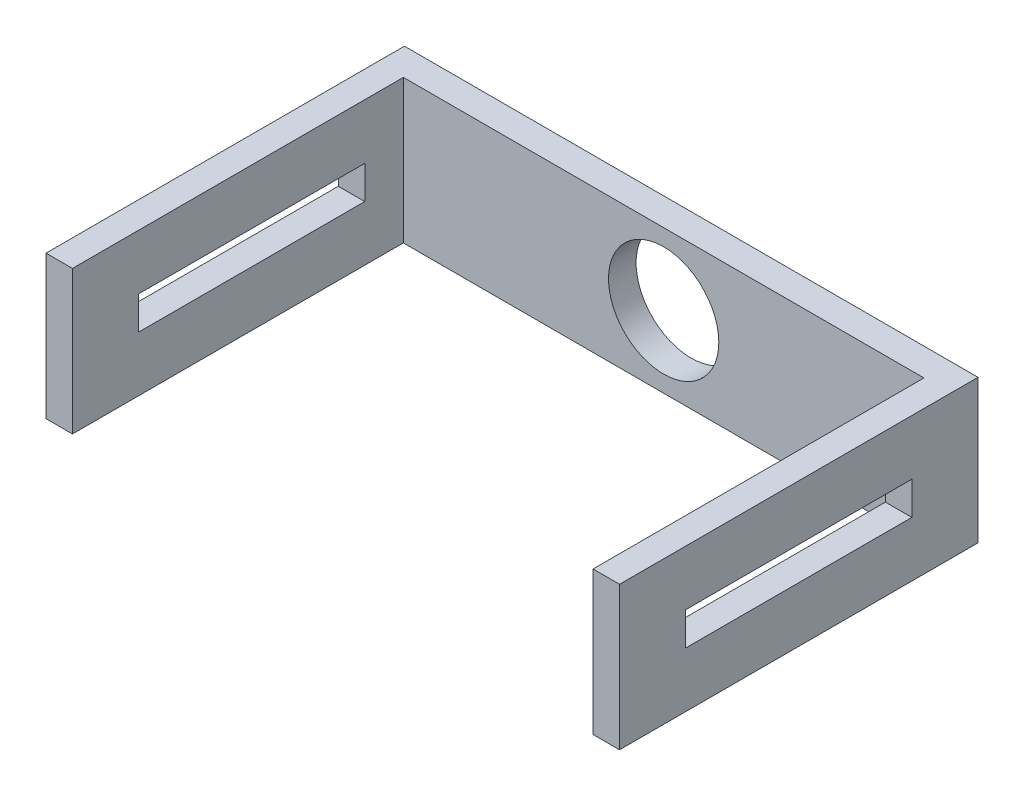
from build123d import *

# Parameters (mm, degrees)
SKETCH1_W           = 52
SKETCH1_H           = 13
BOSS_EXTRUDE1_DEPTH = 2.5
SKETCH2_W           = 2.4
SKETCH2_H           = 13
BOSS_EXTRUDE2_DEPTH = 30
SKETCH3_W           = 20.5
SKETCH3_H           = 3
CUT_EXTRUDE1_DEPTH  = 55
SKETCH4_R           = 5
CUT_EXTRUDE2_DEPTH  = 55


with BuildPart() as part:
    # Sketch1 → Boss-Extrude1 (new body)
    with BuildSketch(Plane.XY):
        with Locations((26, -6.5)):
            Rectangle(SKETCH1_W, SKETCH1_H)
    extrude(amount=BOSS_EXTRUDE1_DEPTH)

    # Sketch2 → Boss-Extrude2 (add)
    with BuildSketch(Plane.XY.offset(2.5)):
        with Locations((1.2, -6.5)):
            Rectangle(SKETCH2_W, SKETCH2_H)
        with Locations((50.8, -6.5)):
            Rectangle(SKETCH2_W, SKETCH2_H)
    extrude(amount=BOSS_EXTRUDE2_DEPTH)

    # Sketch3 → Cut-Extrude1 (cut)
    with BuildSketch(Plane.ZY):
        with Locations((16.25, -6.5)):
            Rectangle(SKETCH3_W, SKETCH3_H)
    extrude(amount=-CUT_EXTRUDE1_DEPTH, mode=Mode.SUBTRACT)

    # Sketch4 → Cut-Extrude2 (cut)
    with BuildSketch(Plane.XY.offset(2.5)):
        with Locations((26, -6.5)):
            Circle(SKETCH4_R)
    extrude(amount=-CUT_EXTRUDE2_DEPTH, mode=Mode.SUBTRACT)


solid = part.part
